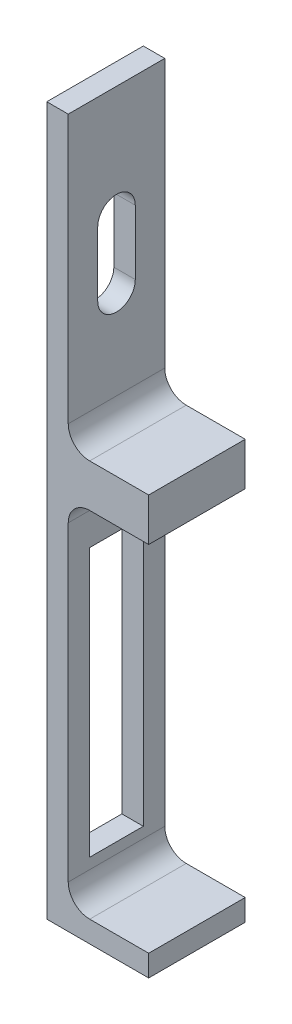
from build123d import *

# Parameters (mm, degrees)
EXTRUDE_1_DEPTH     = 9
CUT_EXTRUDE_2_DEPTH = 68.284842275
SKETCH_6_W          = 5
SKETCH_6_H          = 25
CUT_EXTRUDE_3_DEPTH = 68.031708915
FILLET_1_R          = 2
SKETCH_7_W          = 7.5
SKETCH_7_H          = 4
EXTRUDE_2_DEPTH     = 9
FILLET_2_R          = 2


with BuildPart() as part:
    # Эскиз1 → Бобышка-Вытянуть1 (new body)
    with BuildSketch(Plane.XY):
        Polygon((0, 0), (9.5, 0), (9.5, 2), (2, 2), (2, 66), (0, 66), align=None)
    extrude(amount=EXTRUDE_1_DEPTH)

    # Эскиз4 → Вырез-Вытянуть2 (cut, through all)
    with BuildSketch(Plane.ZY):
        with BuildLine():
            Line((6.25, 55.52), (6.25, 49.52))
            ThreePointArc((6.25, 49.52), (4.5, 47.77), (2.75, 49.52))
            Line((2.75, 49.52), (2.75, 55.52))
            ThreePointArc((2.75, 55.52), (4.5, 57.27), (6.25, 55.52))
        make_face()
    extrude(amount=-CUT_EXTRUDE_2_DEPTH, mode=Mode.SUBTRACT)

    # Эскиз6 → Вырез-Вытянуть3 (cut, through all)
    with BuildSketch(Plane(origin=(2, 0, 0), x_dir=(0, 0, -1), z_dir=(1, 0, 0))):
        with Locations((-4.5, 17.5)):
            Rectangle(SKETCH_6_W, SKETCH_6_H)
    extrude(amount=-CUT_EXTRUDE_3_DEPTH, mode=Mode.SUBTRACT)

    # Скругление1
    fillet_1_edges = [part.edges().sort_by_distance(p)[0] for p in [
        (2, 2, 4.5),
    ]]
    fillet(fillet_1_edges, radius=FILLET_1_R)

    # Эскиз7 → Бобышка-Вытянуть2 (add)
    with BuildSketch(Plane.XY.offset(9)):
        with Locations((5.75, 37)):
            Rectangle(SKETCH_7_W, SKETCH_7_H)
    extrude(amount=-EXTRUDE_2_DEPTH)

    # Скругление2
    fillet_2_edges = [part.edges().sort_by_distance(p)[0] for p in [
        (2, 39, 4.5),
        (2, 35, 4.5),
    ]]
    fillet(fillet_2_edges, radius=FILLET_2_R)


solid = part.part
